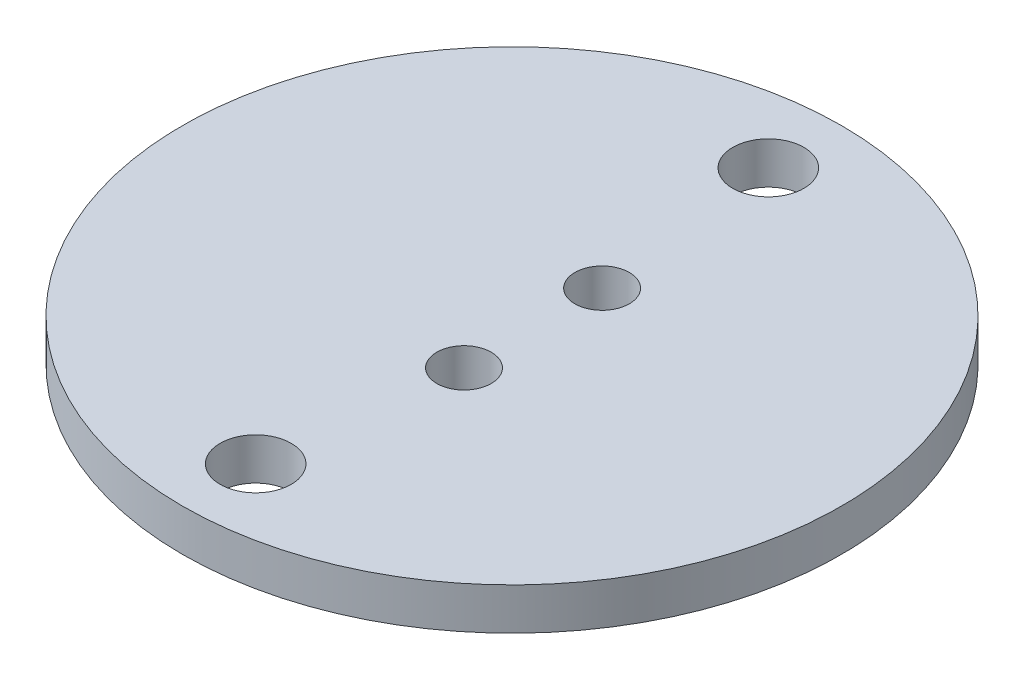
from build123d import *

# Parameters (mm, degrees)
SKETCH1_R           = 7.875
BOSS_EXTRUDE1_DEPTH = 1
SKETCH2_R           = 0.85
CUT_EXTRUDE1_DEPTH  = 12.181737343
SKETCH3_R           = 0.65
CUT_EXTRUDE2_DEPTH  = 11


with BuildPart() as part:
    # Sketch1 → Boss-Extrude1 (new body)
    with BuildSketch(Plane(origin=(0, 0, 0), x_dir=(1, 0, 0), z_dir=(0, 1, 0))):
        with Locations(Location((0, 0, 0), (0, 0, 270))):
            Circle(SKETCH1_R)
    extrude(amount=BOSS_EXTRUDE1_DEPTH)

    # Sketch2 → Cut-Extrude1 (cut, through all)
    with BuildSketch(Plane(origin=(0, 1, 0), x_dir=(1, 0, 0), z_dir=(0, 1, 0))):
        with Locations(Location((0, 6.125, 0), (0, 0, 270))):
            Circle(SKETCH2_R)
        with Locations(Location((0, -6.125, 0), (0, 0, 90))):
            Circle(SKETCH2_R)
    extrude(amount=-CUT_EXTRUDE1_DEPTH, mode=Mode.SUBTRACT)

    # Sketch3 → Cut-Extrude2 (cut)
    with BuildSketch(Plane(origin=(0, 1, 0), x_dir=(1, 0, 0), z_dir=(0, 1, 0))):
        with Locations(Location((0.503115295, 1.65, 0), (0, 0, 270))):
            Circle(SKETCH3_R)
        with Locations(Location((0.503115295, -1.65, 0), (0, 0, 270))):
            Circle(SKETCH3_R)
    extrude(amount=-CUT_EXTRUDE2_DEPTH, mode=Mode.SUBTRACT)


solid = part.part
